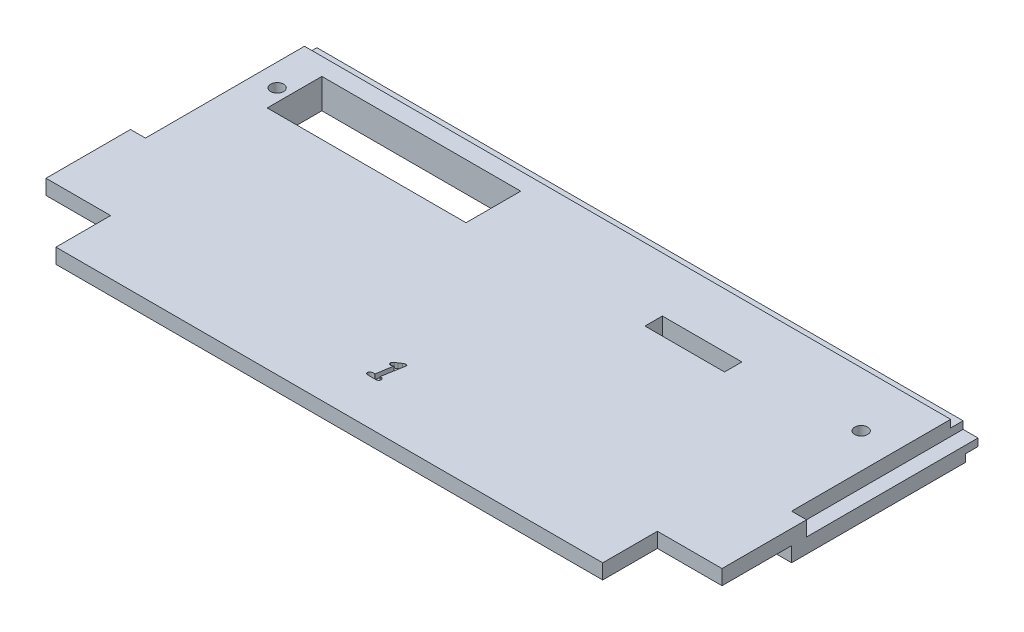
from build123d import *

# Parameters (mm, degrees)
SKETCH_1_W          = 110
SKETCH_1_H          = 3
EXTRUDE_1_DEPTH     = 11
SKETCH_2_W          = 136
SKETCH_2_H          = 3
EXTRUDE_2_DEPTH     = 14
SKETCH_3_W          = 136
SKETCH_3_H          = 6
EXTRUDE_3_DEPTH     = 3
SKETCH_4_W          = 130
SKETCH_4_H          = 3
EXTRUDE_4_DEPTH     = 32
CUT_EXTRUDE_1_DEPTH = 1
EXTRUDE_5_REACH     = 146.613
SKETCH_7_W          = 2.5
SKETCH_7_H          = 3
SKETCH_8_W          = 3
SKETCH_8_H          = 1.5
CUT_EXTRUDE_2_DEPTH = 2.5
SKETCH_9_W          = 3
SKETCH_9_H          = 1.5
CUT_EXTRUDE_3_DEPTH = 2.5
CUT_EXTRUDE_4_REACH = 128.174
SKETCH_10_R         = 1.3
SKETCH_11_W         = 40
SKETCH_11_H         = 11
SKETCH_11_W_2       = 16
SKETCH_11_H_2       = 3.5
CUT_EXTRUDE_5_DEPTH = 127.173778052


with BuildPart() as part:
    # 草圖1 → 填料-伸長1 (new body)
    with BuildSketch(Plane.XY):
        with Locations((-47.028571429, 0.492857143)):
            Rectangle(SKETCH_1_W, SKETCH_1_H)
    extrude(amount=EXTRUDE_1_DEPTH)

    # 草圖2 → 填料-伸長2 (add)
    with BuildSketch(Plane(origin=(0, 0, 0), x_dir=(-1, 0, 0), z_dir=(0, 0, -1))):
        with Locations((47.028571429, 0.492857143)):
            Rectangle(SKETCH_2_W, SKETCH_2_H)
    extrude(amount=EXTRUDE_2_DEPTH)

    # 草圖3 → 填料-伸長3 (add)
    with BuildSketch(Plane(origin=(0, 0, -14), x_dir=(-1, 0, 0), z_dir=(0, 0, -1))):
        with Locations((47.028571429, -1.007142857)):
            Rectangle(SKETCH_3_W, SKETCH_3_H)
    extrude(amount=EXTRUDE_3_DEPTH)

    # 草圖4 → 填料-伸長4 (add)
    with BuildSketch(Plane(origin=(0, 0, -17), x_dir=(-1, 0, 0), z_dir=(0, 0, -1))):
        Polygon((-20.971428571, -4.007142857), (115.028571429, -4.007142857), (115.028571429, -1.007142857), (112.028571429, -1.007142857), (-17.971428571, -1.007142857), (-20.971428571, -1.007142857), align=None)
        with Locations((47.028571429, 0.492857143)):
            Rectangle(SKETCH_4_W, SKETCH_4_H)
    extrude(amount=EXTRUDE_4_DEPTH)

    # 草圖5 → 除料-伸長1 (cut)
    with BuildSketch(Plane(origin=(0, 1.992857143, 0), x_dir=(1, 0, 0), z_dir=(0, 1, 0))):
        with BuildLine():
            add(Edge.make_bspline(
                [(-48.220366343, -1.911036809), (-48.270541407, -1.91028686), (-48.364344083, -1.908884824), (-48.494973246, -1.891233228), (-48.606432782, -1.864670281), (-48.697312182, -1.823968869), (-48.770960962, -1.773790726), (-48.822371595, -1.70830112), (-48.855058169, -1.631392184), (-48.858131064, -1.575902375), (-48.859717816, -1.547249089)],
                knots=[0, 0, 0, 0, 1.45873791, 2.727121924, 3.828833403, 4.779149489, 5.611735354, 6.393729658, 7.170569787, 8, 8, 8, 8], degree=3))
            add(Edge.make_bspline(
                [(-48.859717816, -1.547249089), (-48.859067643, -1.524353202), (-48.857792041, -1.479432717), (-48.848509693, -1.414107352), (-48.830269076, -1.353834434), (-48.807934617, -1.297240882), (-48.776845824, -1.245857786), (-48.73947396, -1.198744224), (-48.695811026, -1.155390258), (-48.643573446, -1.119347879), (-48.58700269, -1.084220527), (-48.522090534, -1.057366485), (-48.452126202, -1.031020798), (-48.374003189, -1.012615071), (-48.28987434, -0.995717942), (-48.198785859, -0.985465569), (-48.101387827, -0.978697318), (-48.034129185, -0.977978226), (-47.99926183, -0.977605443)],
                knots=[0, 0, 0, 0, 0.939525648, 1.843298225, 2.696554254, 3.5181456, 4.333093057, 5.149672587, 5.981863818, 6.845973329, 7.747779578, 8.708210785, 9.721263674, 10.812355027, 11.995550541, 13.240878593, 14.569652006, 16, 16, 16, 16], degree=3))
            Line((-47.99926183, -0.977605443), (-47.92192971, -0.977605443))
            add(Edge.make_bspline(
                [(-47.92192971, -0.977605443), (-47.907747598, -0.977653916), (-47.87818965, -0.977754942), (-47.848927636, -0.981955468), (-47.833705742, -0.984140552)],
                knots=[0, 0, 0, 0, 0.959614092, 2, 2, 2, 2], degree=3))
            Line((-47.833705742, -0.984140552), (-47.316342966, 2.280146269))
            add(Edge.make_bspline(
                [(-47.316342966, 2.280146269), (-47.345668471, 2.262935651), (-47.40078619, 2.230588039), (-47.480262355, 2.186880195), (-47.549909775, 2.148608363), (-47.611299516, 2.1185844), (-47.662490647, 2.093025466), (-47.706107648, 2.078035164), (-47.73968456, 2.064921848), (-47.759932978, 2.063076729), (-47.768354654, 2.062309311)],
                knots=[0, 0, 0, 0, 1.618709582, 3.042388521, 4.318437639, 5.400649213, 6.297638627, 7.036053737, 7.59907764, 8, 8, 8, 8], degree=3))
            add(Edge.make_bspline(
                [(-47.768354654, 2.062309311), (-47.798642133, 2.063656774), (-47.857249869, 2.06626418), (-47.941602172, 2.090018879), (-48.017357284, 2.13011156), (-48.08502679, 2.183226474), (-48.140088137, 2.247846893), (-48.180034599, 2.320139031), (-48.205597516, 2.397901123), (-48.208170919, 2.452041748), (-48.209474495, 2.479467086)],
                knots=[0, 0, 0, 0, 1.075146434, 2.080460303, 3.085028113, 4.105066915, 5.121505953, 6.080595913, 7.027711528, 8, 8, 8, 8], degree=3))
            add(Edge.make_bspline(
                [(-48.209474495, 2.479467086), (-48.208816812, 2.498828628), (-48.207480817, 2.538159014), (-48.190274999, 2.596456162), (-48.166994024, 2.656064112), (-48.13067359, 2.714646481), (-48.086993317, 2.775009305), (-48.033359047, 2.836236327), (-47.968905095, 2.896683711), (-47.921447851, 2.935397881), (-47.89687846, 2.95544084)],
                knots=[0, 0, 0, 0, 0.787225613, 1.599143722, 2.462777159, 3.392467032, 4.399736937, 5.501852795, 6.706668326, 8, 8, 8, 8], degree=3))
            Line((-47.89687846, 2.95544084), (-47.429618184, 3.252788288))
            Line((-47.429618184, 3.252788288), (-46.922058071, 3.608951715))
            add(Edge.make_bspline(
                [(-46.922058071, 3.608951715), (-46.876413832, 3.639138489), (-46.788094754, 3.697548226), (-46.645736231, 3.75807991), (-46.503481767, 3.798286546), (-46.407496481, 3.802782202), (-46.360038718, 3.805004978)],
                knots=[0, 0, 0, 0, 1.084242535, 2.09794932, 3.059573881, 4, 4, 4, 4], degree=3))
            add(Edge.make_bspline(
                [(-46.360038718, 3.805004978), (-46.3381608, 3.804388851), (-46.296781759, 3.803223532), (-46.239109283, 3.788739172), (-46.189869766, 3.765868881), (-46.148963408, 3.733393204), (-46.11814663, 3.690639657), (-46.096158463, 3.638981159), (-46.083357921, 3.578342667), (-46.08195108, 3.53495132), (-46.081207412, 3.512014269)],
                knots=[0, 0, 0, 0, 1.130594233, 2.138361778, 3.055019383, 3.924169546, 4.811632327, 5.75471089, 6.813120257, 8, 8, 8, 8], degree=3))
            add(Edge.make_bspline(
                [(-46.081207412, 3.512014269), (-46.08156363, 3.505479814), (-46.08243511, 3.489493395), (-46.084204273, 3.461029672), (-46.090707373, 3.424207889), (-46.09642404, 3.378657845), (-46.106005481, 3.324747731), (-46.115079801, 3.262129111), (-46.127301873, 3.191363134), (-46.14168701, 3.112256155), (-46.157847106, 3.024360372), (-46.176607518, 2.927900752), (-46.195977289, 2.822862657), (-46.217822392, 2.709597476), (-46.241950094, 2.588075039), (-46.266930873, 2.457651605), (-46.293968395, 2.318923362), (-46.313154025, 2.223498794), (-46.323006436, 2.174495345)],
                knots=[0, 0, 0, 0, 0.23106447, 0.565294867, 1.005764972, 1.549550621, 2.185906339, 2.938197749, 3.783158138, 4.720914698, 5.776755442, 6.938105291, 8.189993867, 9.547402134, 11.010355101, 12.563823371, 14.235417664, 16, 16, 16, 16], degree=3))
            add(Edge.make_bspline(
                [(-46.323006436, 2.174495345), (-46.357825146, 1.994478693), (-46.428386042, 1.629670918), (-46.529401683, 1.074537611), (-46.627786589, 0.504560358), (-46.68938042, 0.119270973), (-46.720558885, -0.075760435)],
                knots=[0, 0, 0, 0, 0.962799145, 1.951134026, 2.962875099, 4, 4, 4, 4], degree=3))
            Line((-46.720558885, -0.075760435), (-46.863242092, -0.969981149))
            Line((-46.863242092, -0.969981149), (-46.621443068, -0.969981149))
            add(Edge.make_bspline(
                [(-46.621443068, -0.969981149), (-46.590828719, -0.971065908), (-46.531735764, -0.97315975), (-46.447558792, -0.994017247), (-46.37289879, -1.030001679), (-46.307480713, -1.077598676), (-46.253676365, -1.136347365), (-46.214944889, -1.204076877), (-46.190689754, -1.279514507), (-46.188165035, -1.332490786), (-46.186858337, -1.359909305)],
                knots=[0, 0, 0, 0, 1.122867763, 2.167401115, 3.157408072, 4.149478012, 5.12172718, 6.059443137, 6.995641138, 8, 8, 8, 8], degree=3))
            add(Edge.make_bspline(
                [(-46.186858337, -1.359909305), (-46.188429675, -1.395769989), (-46.191525997, -1.466433442), (-46.225931374, -1.567887827), (-46.277285831, -1.663022499), (-46.349235784, -1.748021435), (-46.435799472, -1.820134294), (-46.535216898, -1.873541109), (-46.646458865, -1.904887272), (-46.72398679, -1.908939039), (-46.764126276, -1.911036809)],
                knots=[0, 0, 0, 0, 0.967297154, 1.906058354, 2.869352191, 3.881168242, 4.9005468, 5.90310656, 6.91434956, 8, 8, 8, 8], degree=3))
            Line((-46.764126276, -1.911036809), (-48.220366343, -1.911036809))
        make_face()
    extrude(amount=-CUT_EXTRUDE_1_DEPTH, mode=Mode.SUBTRACT)

    # 填料-伸長5: up to this face of the body (flat: up to its plane)
    extrude_5_end = Plane(part.part.faces().sort_by_distance((-115.028571429, -1.526373626, -23.980769231))[0])
    # 草圖7 → 填料-伸長5 (add, up to the picked face)
    with BuildSketch(Plane(origin=(20.971428571, 0, 0), x_dir=(0, 0, -1), z_dir=(1, 0, 0)), mode=Mode.PRIVATE) as extrude_5_sk1:
        with Locations((50.25, -1.007142857)):
            Rectangle(SKETCH_7_W, SKETCH_7_H)
    extrude_5_tool1 = split(extrude(extrude_5_sk1.sketch, amount=-EXTRUDE_5_REACH, mode=Mode.PRIVATE), bisect_by=extrude_5_end, keep=Keep.BOTH, mode=Mode.PRIVATE)
    add(extrude_5_tool1.solids().sort_by(Axis((20.971429, -1.007143, -50.25), (-1, 0, 0)))[0])

    # 草圖8 → 除料-伸長2 (cut)
    with BuildSketch(Plane.XY.offset(-49)):
        with Locations((-113.528571429, -0.257142857)):
            Rectangle(SKETCH_8_W, SKETCH_8_H)
    extrude(amount=-CUT_EXTRUDE_2_DEPTH, mode=Mode.SUBTRACT)

    # 草圖9 → 除料-伸長3 (cut)
    with BuildSketch(Plane.XY.offset(-49)):
        with Locations((19.471428571, -0.257142857)):
            Rectangle(SKETCH_9_W, SKETCH_9_H)
    extrude(amount=-CUT_EXTRUDE_3_DEPTH, mode=Mode.SUBTRACT)

    # 草圖10 → 除料-伸長4 (cut, up to next)
    with BuildSketch(Plane(origin=(0, 1.992857143, 0), x_dir=(1, 0, 0), z_dir=(0, 1, 0)), mode=Mode.PRIVATE) as cut_extrude_4_sk1:
        with Locations(Location((-107.528571429, 39, 0), (0, 0, 270))):
            Circle(SKETCH_10_R)
    cut_extrude_4_tool1 = extrude(cut_extrude_4_sk1.sketch, amount=-CUT_EXTRUDE_4_REACH, mode=Mode.PRIVATE) & part.part
    # 草圖10 → 除料-伸長4 (cut, up to next)
    with BuildSketch(Plane(origin=(0, 1.992857143, 0), x_dir=(1, 0, 0), z_dir=(0, 1, 0)), mode=Mode.PRIVATE) as cut_extrude_4_sk2:
        with Locations(Location((10.971428571, 38, 0), (0, 0, 270))):
            Circle(SKETCH_10_R)
    cut_extrude_4_tool2 = extrude(cut_extrude_4_sk2.sketch, amount=-CUT_EXTRUDE_4_REACH, mode=Mode.PRIVATE) & part.part
    add(cut_extrude_4_tool1.solids().sort_by_distance((-107.528571, 1.992857, -39))[0], mode=Mode.SUBTRACT)
    add(cut_extrude_4_tool2.solids().sort_by_distance((10.971429, 1.992857, -38))[0], mode=Mode.SUBTRACT)

    # 草圖11 → 除料-伸長5 (cut, through all)
    with BuildSketch(Plane(origin=(0, 1.992857143, 0), x_dir=(1, 0, 0), z_dir=(0, 1, 0))):
        with Locations((-85.028571429, 40)):
            Rectangle(SKETCH_11_W, SKETCH_11_H)
        with Locations((-21.028571429, 36.25)):
            Rectangle(SKETCH_11_W_2, SKETCH_11_H_2)
    extrude(amount=-CUT_EXTRUDE_5_DEPTH, mode=Mode.SUBTRACT)


solid = part.part
